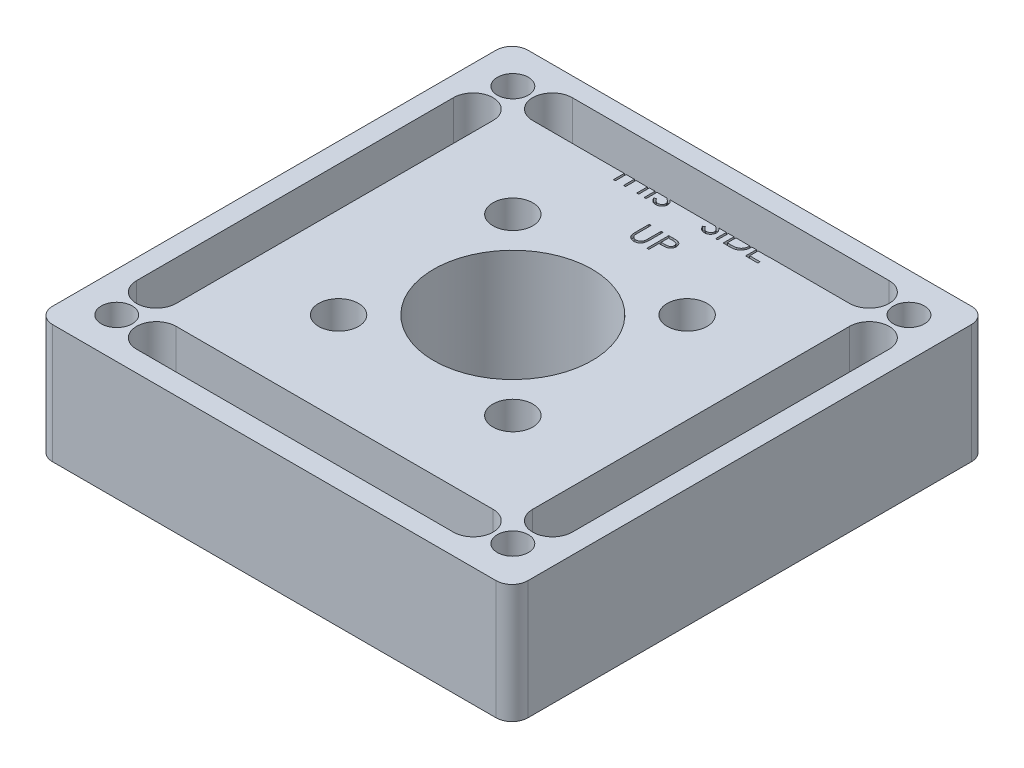
from build123d import *

# Parameters (mm, degrees)
SKETCH1_R                           = 12.7
BOSS_EXTRUDE2_DEPTH                 = 19.05
SKETCH3_R                           = 3.2
CUT_EXTRUDE2_DEPTH                  = 17.145
F_3_2_3_2_DIAMETER_HOLE2_AT_2_COUNT = 2
F_3_2_3_2_DIAMETER_HOLE2_AT_2_PITCH = 27.94
F_3_2_3_2_DIAMETER_HOLE2_AT_3_COUNT = 2
F_3_2_3_2_DIAMETER_HOLE2_AT_3_PITCH = 39.513126933
F_3_2_3_2_DIAMETER_HOLE2_AT_4_COUNT = 2
F_3_2_3_2_DIAMETER_HOLE2_AT_4_PITCH = 27.94
F_10_CLEARANCE_HOLE1_D              = 4.9784
SKETCH10_W                          = 0.314102565
SKETCH10_H                          = 3.5
SKETCH10_W_2                        = 0.314102564
CUT_EXTRUDE1_DEPTH                  = 0.635
FILLET2_R                           = 2.54
CUT_EXTRUDE3_DEPTH                  = 50.8


with BuildPart() as part:
    # Sketch1 → Boss-Extrude2 (new body)
    with BuildSketch(Plane(origin=(0, 0, 0), x_dir=(1, 0, 0), z_dir=(0, 1, 0))):
        Polygon((3.169508099, 88.395089045), (41.269508099, 88.395089045), (41.269508099, 12.195089045), (-34.930491901, 12.195089045), (-34.930491901, 88.395089045), align=None)
        with Locations(Location((3.169508099, 50.431775554, 0), (0, 0, 90))):
            Circle(SKETCH1_R, mode=Mode.SUBTRACT)
    extrude(amount=BOSS_EXTRUDE2_DEPTH)

    # Sketch3 → Cut-Extrude2 (cut)
    with BuildSketch(Plane(origin=(0, 19.05, 0), x_dir=(1, 0, 0), z_dir=(0, 1, 0))):
        with Locations(Location((17.139508099, 36.461775554, 0), (0, 0, 270))):
            Circle(SKETCH3_R)
        with Locations(Location((-10.800491901, 36.461775554, 0), (0, 0, 270))):
            Circle(SKETCH3_R)
        with Locations(Location((17.139508099, 64.401775554, 0), (0, 0, 270))):
            Circle(SKETCH3_R)
        with Locations(Location((-10.800491901, 64.401775554, 0), (0, 0, 270))):
            Circle(SKETCH3_R)
    extrude(amount=-CUT_EXTRUDE2_DEPTH, mode=Mode.SUBTRACT)

    # Sketch5 → Ø3.2 (3.2) Diameter Hole2 (revolve, cut)
    with BuildSketch(Plane(origin=(-10.800491901, 1.905, -64.401775554), x_dir=(0, 0, 1), z_dir=(1, 0, 0))):
        Polygon((0, 0), (0, 1.905), (1.6, 1.905), (1.6, 1.4), (3, 0), align=None)
    f_3_2_3_2_diameter_hole2 = revolve(axis=Axis((-10.800491901, 8.255, -64.401775554), (0, -1, 0)), mode=Mode.SUBTRACT)

    # Ø3.2 (3.2) Diameter Hole2 at 2: Ø3.2 (3.2) Diameter Hole2 ×2
    with Locations(*[(i * F_3_2_3_2_DIAMETER_HOLE2_AT_2_PITCH, 0, 0) for i in range(1, F_3_2_3_2_DIAMETER_HOLE2_AT_2_COUNT)]):
        add(f_3_2_3_2_diameter_hole2, mode=Mode.SUBTRACT)

    # Ø3.2 (3.2) Diameter Hole2 at 3: Ø3.2 (3.2) Diameter Hole2 ×2
    with Locations(*[Vector(0.7071067811865479, 0, 0.7071067811865471) * (i * F_3_2_3_2_DIAMETER_HOLE2_AT_3_PITCH) for i in range(1, F_3_2_3_2_DIAMETER_HOLE2_AT_3_COUNT)]):
        add(f_3_2_3_2_diameter_hole2, mode=Mode.SUBTRACT)

    # Ø3.2 (3.2) Diameter Hole2 at 4: Ø3.2 (3.2) Diameter Hole2 ×2
    with Locations(*[(0, 0, i * F_3_2_3_2_DIAMETER_HOLE2_AT_4_PITCH) for i in range(1, F_3_2_3_2_DIAMETER_HOLE2_AT_4_COUNT)]):
        add(f_3_2_3_2_diameter_hole2, mode=Mode.SUBTRACT)

    # #10 Clearance Hole1 (through all)
    with Locations(Plane(origin=(0, 19.05, 0), x_dir=(1, 0, 0), z_dir=(0, 1, 0))):
        with Locations((34.919508099, 82.181775554), (-28.580491901, 82.181775554), (-28.580491901, 18.681775554), (34.919508099, 18.681775554)):
            Hole(F_10_CLEARANCE_HOLE1_D / 2)

    # Sketch10 → Cut-Extrude1 (cut)
    # profile 1 of 10: a face of its own
    with BuildSketch(Plane(origin=(0, 19.05, 0), x_dir=(1, 0, 0), z_dir=(0, 1, 0))):
        Polygon((-8.308104822, 80.409203908), (-8.308104822, 80.768178267), (-6.468361233, 80.768178267), (-6.468361233, 80.409203908), (-7.231181745, 80.409203908), (-7.231181745, 77.268178267), (-7.545284309, 77.268178267), (-7.545284309, 80.409203908), align=None)
    # profile 2 of 10: a face of its own
    with BuildSketch(Plane(origin=(0, 19.05, 0), x_dir=(1, 0, 0), z_dir=(0, 1, 0))):
        Polygon((-5.929899694, 80.768178267), (-5.61579713, 80.768178267), (-5.61579713, 79.332280831), (-3.820925335, 79.332280831), (-3.820925335, 80.768178267), (-3.506822771, 80.768178267), (-3.506822771, 77.268178267), (-3.820925335, 77.268178267), (-3.820925335, 78.973306472), (-5.61579713, 78.973306472), (-5.61579713, 77.268178267), (-5.929899694, 77.268178267), align=None)
    # profile 3 of 10: a face of its own
    with BuildSketch(Plane(origin=(0, 19.05, 0), x_dir=(1, 0, 0), z_dir=(0, 1, 0))):
        with Locations((-2.452335592, 79.018178267)):
            Rectangle(SKETCH10_W, SKETCH10_H)
    # profile 4 of 10: a face of its own
    with BuildSketch(Plane(origin=(0, 19.05, 0), x_dir=(1, 0, 0), z_dir=(0, 1, 0))):
        with BuildLine():
            Line((-1.756822771, 77.943358555), (-1.460949374, 78.120742369))
            add(Edge.make_bspline(
                [(-1.460949374, 78.120742369), (-1.433431136, 78.074677984), (-1.380707256, 77.9864204), (-1.292755897, 77.86716236), (-1.201622985, 77.765800203), (-1.106633652, 77.682923596), (-1.008367704, 77.617674709), (-0.90618365, 77.571472477), (-0.800425839, 77.542656502), (-0.728452018, 77.539156415), (-0.692519886, 77.537409036)],
                knots=[0, 0, 0, 0, 1.272034388, 2.437168799, 3.508375237, 4.49857839, 5.41946034, 6.295179144, 7.148887113, 8, 8, 8, 8], degree=3))
            add(Edge.make_bspline(
                [(-0.692519886, 77.537409036), (-0.661833026, 77.538263709), (-0.600996253, 77.539958099), (-0.51143401, 77.556238901), (-0.424452208, 77.58125103), (-0.34184357, 77.617071961), (-0.264747955, 77.660410447), (-0.19714126, 77.712756624), (-0.138695147, 77.77136283), (-0.090886032, 77.836745485), (-0.054205997, 77.907062633), (-0.026013929, 77.979238585), (-0.010368855, 78.054407153), (-0.008012101, 78.105017616), (-0.006822771, 78.130558074)],
                knots=[0, 0, 0, 0, 1.095163259, 2.171163733, 3.241058638, 4.321873601, 5.38011039, 6.391990106, 7.366004449, 8.327778327, 9.272591725, 10.192022065, 11.087607919, 12, 12, 12, 12], degree=3))
            add(Edge.make_bspline(
                [(-0.006822771, 78.130558074), (-0.008297082, 78.159698924), (-0.01129414, 78.218938013), (-0.03662562, 78.306337666), (-0.076474867, 78.392830236), (-0.113237511, 78.446331502), (-0.132323572, 78.474107754)],
                knots=[0, 0, 0, 0, 0.938893495, 1.908633276, 2.914225137, 4, 4, 4, 4], degree=3))
            add(Edge.make_bspline(
                [(-0.132323572, 78.474107754), (-0.147994186, 78.494154578), (-0.180892681, 78.536240376), (-0.237450193, 78.598885612), (-0.303816308, 78.663504031), (-0.377719863, 78.732563088), (-0.461852951, 78.802850884), (-0.553580466, 78.877719162), (-0.655244325, 78.954320739), (-0.726543821, 79.005693305), (-0.763333188, 79.032200703)],
                knots=[0, 0, 0, 0, 0.722233717, 1.516239348, 2.393582979, 3.351407094, 4.387010283, 5.505090956, 6.712668013, 8, 8, 8, 8], degree=3))
            add(Edge.make_bspline(
                [(-0.763333188, 79.032200703), (-0.800157184, 79.05842929), (-0.87056186, 79.108576353), (-0.969020443, 79.183000637), (-1.057064906, 79.251044506), (-1.134303922, 79.313348518), (-1.200703519, 79.369921123), (-1.25678693, 79.420219062), (-1.301125487, 79.465602623), (-1.325781068, 79.495043965), (-1.336850816, 79.508262401)],
                knots=[0, 0, 0, 0, 1.452282411, 2.77665338, 3.964542531, 5.026858415, 5.96415736, 6.766646006, 7.446254459, 8, 8, 8, 8], degree=3))
            add(Edge.make_bspline(
                [(-1.336850816, 79.508262401), (-1.352323361, 79.528863438), (-1.382752198, 79.569378142), (-1.422918203, 79.632703), (-1.457057366, 79.697526265), (-1.483819698, 79.76402213), (-1.506355917, 79.831257059), (-1.521513848, 79.900108304), (-1.531005245, 79.970266923), (-1.531977231, 80.017480423), (-1.532463797, 80.041114966)],
                knots=[0, 0, 0, 0, 1.068054152, 2.10047183, 3.106115577, 4.101338837, 5.06977816, 6.043150881, 7.020423561, 8, 8, 8, 8], degree=3))
            add(Edge.make_bspline(
                [(-1.532463797, 80.041114966), (-1.531158588, 80.07814474), (-1.528576068, 80.151412804), (-1.50673555, 80.258443634), (-1.472262657, 80.360630051), (-1.423967769, 80.456960385), (-1.361710416, 80.544926366), (-1.289664442, 80.625539853), (-1.203852955, 80.693308435), (-1.109700332, 80.752520494), (-1.00664396, 80.798866419), (-0.898653057, 80.833827399), (-0.785555985, 80.853636657), (-0.70895285, 80.856479422), (-0.670083989, 80.857921857)],
                knots=[0, 0, 0, 0, 1.005424448, 1.989358655, 2.955360095, 3.929531133, 4.905563448, 5.876582895, 6.856512386, 7.866279853, 8.892233794, 9.918561126, 10.94386622, 12, 12, 12, 12], degree=3))
            add(Edge.make_bspline(
                [(-0.670083989, 80.857921857), (-0.628839889, 80.856499305), (-0.546818537, 80.853670304), (-0.426169321, 80.829072773), (-0.310008605, 80.788372101), (-0.21656534, 80.742183443), (-0.143432579, 80.696052027), (-0.087659846, 80.654032203), (-0.031142395, 80.605657094), (0.02657566, 80.550797848), (0.084516319, 80.488951097), (0.143539771, 80.420540408), (0.20378404, 80.345983852), (0.2425399, 80.292759351), (0.262407998, 80.26547394)],
                knots=[0, 0, 0, 0, 1.286793592, 2.559021753, 3.825965368, 5.121522368, 5.803751409, 6.523245864, 7.299691795, 8.125521123, 9.008227632, 9.944561021, 10.946284179, 12, 12, 12, 12], degree=3))
            Line((0.262407998, 80.26547394), (-0.021546329, 80.050229549))
            add(Edge.make_bspline(
                [(-0.021546329, 80.050229549), (-0.038692261, 80.072318239), (-0.071711318, 80.114855892), (-0.121840805, 80.174427208), (-0.169089453, 80.228843688), (-0.215639853, 80.276108816), (-0.259033484, 80.318810949), (-0.301150527, 80.355370706), (-0.341384878, 80.386146301), (-0.392101788, 80.418989861), (-0.455819507, 80.451546365), (-0.535804043, 80.479095443), (-0.619390318, 80.495650505), (-0.67631995, 80.497839392), (-0.705140079, 80.498947498)],
                knots=[0, 0, 0, 0, 1.181633172, 2.275549214, 3.290209073, 4.226197932, 5.078386478, 5.862611352, 6.581680152, 7.217281963, 8.414376989, 9.595101626, 10.782541182, 12, 12, 12, 12], degree=3))
            add(Edge.make_bspline(
                [(-0.705140079, 80.498947498), (-0.741296601, 80.497735798), (-0.811021049, 80.495399148), (-0.910011285, 80.469879163), (-0.99910521, 80.429697303), (-1.075657775, 80.373382325), (-1.139394752, 80.306661332), (-1.185500211, 80.229882477), (-1.213250375, 80.145100074), (-1.216636655, 80.085958418), (-1.218361233, 80.055838523)],
                knots=[0, 0, 0, 0, 1.14458467, 2.207223713, 3.21896685, 4.227309161, 5.202851033, 6.127160689, 7.046193047, 8, 8, 8, 8], degree=3))
            add(Edge.make_bspline(
                [(-1.218361233, 80.055838523), (-1.217968106, 80.037087045), (-1.21718121, 79.999553425), (-1.206206412, 79.944102003), (-1.192107083, 79.888790664), (-1.169764451, 79.833868081), (-1.138919148, 79.778373722), (-1.098413972, 79.721351984), (-1.04740066, 79.662300276), (-1.008323648, 79.623892902), (-0.987692162, 79.603614966)],
                knots=[0, 0, 0, 0, 0.858281714, 1.717966888, 2.583508476, 3.4729293, 4.427298488, 5.488583878, 6.674047936, 8, 8, 8, 8], degree=3))
            add(Edge.make_bspline(
                [(-0.987692162, 79.603614966), (-0.98003079, 79.59677794), (-0.961829123, 79.580534731), (-0.928553197, 79.553942451), (-0.884610399, 79.521139678), (-0.831148197, 79.480552362), (-0.767180836, 79.4334709), (-0.692701279, 79.380497288), (-0.608539747, 79.319911829), (-0.548817831, 79.277554288), (-0.517239438, 79.255157433)],
                knots=[0, 0, 0, 0, 0.420754252, 0.999615792, 1.744751191, 2.668019286, 3.750313428, 4.999500688, 6.413464383, 8, 8, 8, 8], degree=3))
            add(Edge.make_bspline(
                [(-0.517239438, 79.255157433), (-0.479253524, 79.227516074), (-0.405699068, 79.173992412), (-0.301041488, 79.093576732), (-0.20614768, 79.014928964), (-0.120684476, 78.938551356), (-0.043807568, 78.865023263), (0.023630153, 78.793460083), (0.082315833, 78.72437451), (0.145495051, 78.635801935), (0.210052871, 78.52702085), (0.265494378, 78.393742612), (0.300452726, 78.259946291), (0.305024241, 78.170019455), (0.307279793, 78.125650222)],
                knots=[0, 0, 0, 0, 1.163667725, 2.253281268, 3.268753668, 4.215851969, 5.092017293, 5.902905408, 6.650798638, 7.335211899, 8.59617414, 9.77448103, 10.901945474, 12, 12, 12, 12], degree=3))
            add(Edge.make_bspline(
                [(0.307279793, 78.125650222), (0.306622655, 78.094271857), (0.30532114, 78.032124473), (0.290360226, 77.940869396), (0.268440561, 77.852238527), (0.235403327, 77.767327414), (0.195080169, 77.684582652), (0.143913921, 77.606174751), (0.084606236, 77.530368353), (0.016572471, 77.459184861), (-0.057873431, 77.393838665), (-0.136557126, 77.335709604), (-0.219607399, 77.28724128), (-0.306573715, 77.247690438), (-0.397476052, 77.216756921), (-0.492283836, 77.194344052), (-0.591153347, 77.180588341), (-0.658353829, 77.179160579), (-0.692519886, 77.178434677)],
                knots=[0, 0, 0, 0, 0.983748083, 1.948392443, 2.894712957, 3.844097841, 4.80183111, 5.778335162, 6.776009319, 7.81870978, 8.863265674, 9.881300176, 10.883814829, 11.87499822, 12.874611388, 13.892143829, 14.928324115, 16, 16, 16, 16], degree=3))
            add(Edge.make_bspline(
                [(-0.692519886, 77.178434677), (-0.718955229, 77.178945859), (-0.771492989, 77.179961784), (-0.849202471, 77.188943064), (-0.925342061, 77.201650168), (-0.998956343, 77.221824238), (-1.070993754, 77.246301215), (-1.141140989, 77.276439548), (-1.209432043, 77.312556749), (-1.276249625, 77.353851774), (-1.3414238, 77.401909518), (-1.404343268, 77.457883015), (-1.467072453, 77.52022852), (-1.52775985, 77.590639083), (-1.587632994, 77.667977166), (-1.645511404, 77.752966349), (-1.702593121, 77.845143703), (-1.738408589, 77.910008789), (-1.756822771, 77.943358555)],
                knots=[0, 0, 0, 0, 0.915332311, 1.819136955, 2.706846663, 3.586547465, 4.459518054, 5.340707479, 6.227863349, 7.133153174, 8.059268498, 9.028702269, 10.047606654, 11.120612155, 12.245963614, 13.433783089, 14.680604001, 16, 16, 16, 16], degree=3))
        make_face()
    # profile 5 of 10: a face of its own
    with BuildSketch(Plane(origin=(0, 19.05, 0), x_dir=(1, 0, 0), z_dir=(0, 1, 0))):
        with BuildLine():
            Line((6.050869537, 77.943358555), (6.346742934, 78.120742369))
            add(Edge.make_bspline(
                [(6.346742934, 78.120742369), (6.374261171, 78.074677984), (6.426985052, 77.9864204), (6.514936411, 77.86716236), (6.606069322, 77.765800203), (6.701058656, 77.682923596), (6.799324604, 77.617674709), (6.901508658, 77.571472477), (7.007266468, 77.542656502), (7.07924029, 77.539156415), (7.115172421, 77.537409036)],
                knots=[0, 0, 0, 0, 1.272034388, 2.437168799, 3.508375237, 4.49857839, 5.41946034, 6.295179144, 7.148887113, 8, 8, 8, 8], degree=3))
            add(Edge.make_bspline(
                [(7.115172421, 77.537409036), (7.145859282, 77.538263709), (7.206696055, 77.539958099), (7.296258298, 77.556238901), (7.3832401, 77.58125103), (7.465848738, 77.617071961), (7.542944352, 77.660410447), (7.610551048, 77.712756624), (7.668997161, 77.77136283), (7.716806275, 77.836745485), (7.753486311, 77.907062633), (7.781678379, 77.979238585), (7.797323453, 78.054407153), (7.799680206, 78.105017616), (7.800869537, 78.130558074)],
                knots=[0, 0, 0, 0, 1.095163259, 2.171163733, 3.241058638, 4.321873601, 5.38011039, 6.391990106, 7.366004449, 8.327778327, 9.272591725, 10.192022065, 11.087607919, 12, 12, 12, 12], degree=3))
            add(Edge.make_bspline(
                [(7.800869537, 78.130558074), (7.799395226, 78.159698924), (7.796398168, 78.218938013), (7.771066688, 78.306337666), (7.731217441, 78.392830236), (7.694454797, 78.446331502), (7.675368735, 78.474107754)],
                knots=[0, 0, 0, 0, 0.938893495, 1.908633276, 2.914225137, 4, 4, 4, 4], degree=3))
            add(Edge.make_bspline(
                [(7.675368735, 78.474107754), (7.659698121, 78.494154578), (7.626799627, 78.536240376), (7.570242114, 78.598885612), (7.503876, 78.663504031), (7.429972445, 78.732563088), (7.345839356, 78.802850884), (7.254111842, 78.877719162), (7.152447983, 78.954320739), (7.081148486, 79.005693305), (7.04435912, 79.032200703)],
                knots=[0, 0, 0, 0, 0.722233717, 1.516239348, 2.393582979, 3.351407094, 4.387010283, 5.505090956, 6.712668013, 8, 8, 8, 8], degree=3))
            add(Edge.make_bspline(
                [(7.04435912, 79.032200703), (7.007535124, 79.05842929), (6.937130447, 79.108576353), (6.838671865, 79.183000637), (6.750627402, 79.251044506), (6.673388385, 79.313348518), (6.606988789, 79.369921123), (6.550905377, 79.420219062), (6.50656682, 79.465602623), (6.48191124, 79.495043965), (6.470841492, 79.508262401)],
                knots=[0, 0, 0, 0, 1.452282411, 2.77665338, 3.964542531, 5.026858415, 5.96415736, 6.766646006, 7.446254459, 8, 8, 8, 8], degree=3))
            add(Edge.make_bspline(
                [(6.470841492, 79.508262401), (6.455368947, 79.528863438), (6.42494011, 79.569378142), (6.384774104, 79.632703), (6.350634942, 79.697526265), (6.323872609, 79.76402213), (6.301336391, 79.831257059), (6.28617846, 79.900108304), (6.276687063, 79.970266923), (6.275715076, 80.017480423), (6.275228511, 80.041114966)],
                knots=[0, 0, 0, 0, 1.068054152, 2.10047183, 3.106115577, 4.101338837, 5.06977816, 6.043150881, 7.020423561, 8, 8, 8, 8], degree=3))
            add(Edge.make_bspline(
                [(6.275228511, 80.041114966), (6.27653372, 80.07814474), (6.27911624, 80.151412804), (6.300956757, 80.258443634), (6.335429651, 80.360630051), (6.383724539, 80.456960385), (6.445981892, 80.544926366), (6.518027866, 80.625539853), (6.603839352, 80.693308435), (6.697991976, 80.752520494), (6.801048348, 80.798866419), (6.909039251, 80.833827399), (7.022136323, 80.853636657), (7.098739458, 80.856479422), (7.137608319, 80.857921857)],
                knots=[0, 0, 0, 0, 1.005424448, 1.989358655, 2.955360095, 3.929531133, 4.905563448, 5.876582895, 6.856512386, 7.866279853, 8.892233794, 9.918561126, 10.94386622, 12, 12, 12, 12], degree=3))
            add(Edge.make_bspline(
                [(7.137608319, 80.857921857), (7.178852419, 80.856499305), (7.260873771, 80.853670304), (7.381522986, 80.829072773), (7.497683703, 80.788372101), (7.591126968, 80.742183443), (7.664259729, 80.696052027), (7.720032462, 80.654032203), (7.776549912, 80.605657094), (7.834267967, 80.550797848), (7.892208627, 80.488951097), (7.951232079, 80.420540408), (8.011476348, 80.345983852), (8.050232208, 80.292759351), (8.070100306, 80.26547394)],
                knots=[0, 0, 0, 0, 1.286793592, 2.559021753, 3.825965368, 5.121522368, 5.803751409, 6.523245864, 7.299691795, 8.125521123, 9.008227632, 9.944561021, 10.946284179, 12, 12, 12, 12], degree=3))
            Line((8.070100306, 80.26547394), (7.786145979, 80.050229549))
            add(Edge.make_bspline(
                [(7.786145979, 80.050229549), (7.769000046, 80.072318239), (7.735980989, 80.114855892), (7.685851503, 80.174427208), (7.638602855, 80.228843688), (7.592052455, 80.276108816), (7.548658823, 80.318810949), (7.506541781, 80.355370706), (7.46630743, 80.386146301), (7.415590519, 80.418989861), (7.351872801, 80.451546365), (7.271888265, 80.479095443), (7.18830199, 80.495650505), (7.131372358, 80.497839392), (7.102552229, 80.498947498)],
                knots=[0, 0, 0, 0, 1.181633172, 2.275549214, 3.290209073, 4.226197932, 5.078386478, 5.862611352, 6.581680152, 7.217281963, 8.414376989, 9.595101626, 10.782541182, 12, 12, 12, 12], degree=3))
            add(Edge.make_bspline(
                [(7.102552229, 80.498947498), (7.066395707, 80.497735798), (6.996671259, 80.495399148), (6.897681023, 80.469879163), (6.808587098, 80.429697303), (6.732034533, 80.373382325), (6.668297556, 80.306661332), (6.622192097, 80.229882477), (6.594441933, 80.145100074), (6.591055653, 80.085958418), (6.589331075, 80.055838523)],
                knots=[0, 0, 0, 0, 1.14458467, 2.207223713, 3.21896685, 4.227309161, 5.202851033, 6.127160689, 7.046193047, 8, 8, 8, 8], degree=3))
            add(Edge.make_bspline(
                [(6.589331075, 80.055838523), (6.589724202, 80.037087045), (6.590511098, 79.999553425), (6.601485896, 79.944102003), (6.615585225, 79.888790664), (6.637927856, 79.833868081), (6.66877316, 79.778373722), (6.709278336, 79.721351984), (6.760291648, 79.662300276), (6.79936866, 79.623892902), (6.820000146, 79.603614966)],
                knots=[0, 0, 0, 0, 0.858281714, 1.717966888, 2.583508476, 3.4729293, 4.427298488, 5.488583878, 6.674047936, 8, 8, 8, 8], degree=3))
            add(Edge.make_bspline(
                [(6.820000146, 79.603614966), (6.827661518, 79.59677794), (6.845863185, 79.580534731), (6.879139111, 79.553942451), (6.923081909, 79.521139678), (6.97654411, 79.480552362), (7.040511472, 79.4334709), (7.114991028, 79.380497288), (7.199152561, 79.319911829), (7.258874477, 79.277554288), (7.29045287, 79.255157433)],
                knots=[0, 0, 0, 0, 0.420754252, 0.999615792, 1.744751191, 2.668019286, 3.750313428, 4.999500688, 6.413464383, 8, 8, 8, 8], degree=3))
            add(Edge.make_bspline(
                [(7.29045287, 79.255157433), (7.328438783, 79.227516074), (7.40199324, 79.173992412), (7.50665082, 79.093576732), (7.601544628, 79.014928964), (7.687007831, 78.938551356), (7.76388474, 78.865023263), (7.83132246, 78.793460083), (7.890008141, 78.72437451), (7.953187359, 78.635801935), (8.017745179, 78.52702085), (8.073186686, 78.393742612), (8.108145034, 78.259946291), (8.112716549, 78.170019455), (8.114972101, 78.125650222)],
                knots=[0, 0, 0, 0, 1.163667725, 2.253281268, 3.268753668, 4.215851969, 5.092017293, 5.902905408, 6.650798638, 7.335211899, 8.59617414, 9.77448103, 10.901945474, 12, 12, 12, 12], degree=3))
            add(Edge.make_bspline(
                [(8.114972101, 78.125650222), (8.114314963, 78.094271857), (8.113013448, 78.032124473), (8.098052534, 77.940869396), (8.076132869, 77.852238527), (8.043095635, 77.767327414), (8.002772476, 77.684582652), (7.951606229, 77.606174751), (7.892298544, 77.530368353), (7.824264779, 77.459184861), (7.749818877, 77.393838665), (7.671135182, 77.335709604), (7.588084909, 77.28724128), (7.501118592, 77.247690438), (7.410216256, 77.216756921), (7.315408472, 77.194344052), (7.216538961, 77.180588341), (7.149338479, 77.179160579), (7.115172421, 77.178434677)],
                knots=[0, 0, 0, 0, 0.983748083, 1.948392443, 2.894712957, 3.844097841, 4.80183111, 5.778335162, 6.776009319, 7.81870978, 8.863265674, 9.881300176, 10.883814829, 11.87499822, 12.874611388, 13.892143829, 14.928324115, 16, 16, 16, 16], degree=3))
            add(Edge.make_bspline(
                [(7.115172421, 77.178434677), (7.088737078, 77.178945859), (7.036199318, 77.179961784), (6.958489836, 77.188943064), (6.882350247, 77.201650168), (6.808735965, 77.221824238), (6.736698553, 77.246301215), (6.666551319, 77.276439548), (6.598260265, 77.312556749), (6.531442682, 77.353851774), (6.466268508, 77.401909518), (6.40334904, 77.457883015), (6.340619854, 77.52022852), (6.279932458, 77.590639083), (6.220059314, 77.667977166), (6.162180904, 77.752966349), (6.105099186, 77.845143703), (6.069283719, 77.910008789), (6.050869537, 77.943358555)],
                knots=[0, 0, 0, 0, 0.915332311, 1.819136955, 2.706846663, 3.586547465, 4.459518054, 5.340707479, 6.227863349, 7.133153174, 8.059268498, 9.028702269, 10.047606654, 11.120612155, 12.245963614, 13.433783089, 14.680604001, 16, 16, 16, 16], degree=3))
        make_face()
    # profile 6 of 10: a face of its own
    with BuildSketch(Plane(origin=(0, 19.05, 0), x_dir=(1, 0, 0), z_dir=(0, 1, 0))):
        with Locations((8.989972101, 79.018178267)):
            Rectangle(SKETCH10_W_2, SKETCH10_H)
    # profile 7 of 10: a face of its own
    with BuildSketch(Plane(origin=(0, 19.05, 0), x_dir=(1, 0, 0), z_dir=(0, 1, 0))):
        with BuildLine():
            Line((10.04445928, 77.268178267), (10.04445928, 80.768178267))
            Line((10.04445928, 80.768178267), (10.751190049, 80.768178267))
            add(Edge.make_bspline(
                [(10.751190049, 80.768178267), (10.812659038, 80.767735697), (10.931416803, 80.766880654), (11.10302925, 80.761459263), (11.261813013, 80.751868797), (11.407245872, 80.737899271), (11.539727084, 80.720746237), (11.658885692, 80.699245833), (11.765337835, 80.673857662), (11.830807276, 80.652212212), (11.861766973, 80.641976344)],
                knots=[0, 0, 0, 0, 1.314313732, 2.53924729, 3.670748893, 4.714932338, 5.66265055, 6.526160246, 7.303039223, 8, 8, 8, 8], degree=3))
            add(Edge.make_bspline(
                [(11.861766973, 80.641976344), (11.902261712, 80.626545638), (11.982332904, 80.596034144), (12.096340027, 80.538477843), (12.20366539, 80.473264741), (12.304884535, 80.400308878), (12.397685361, 80.31754453), (12.485693258, 80.228487444), (12.565307981, 80.129899104), (12.638216278, 80.023824116), (12.703951937, 79.911512064), (12.761091095, 79.793176955), (12.808545088, 79.669419747), (12.847938315, 79.540584599), (12.878984772, 79.406388221), (12.900166704, 79.266674355), (12.914137694, 79.121995166), (12.915541745, 79.023820702), (12.916254152, 78.974007594)],
                knots=[0, 0, 0, 0, 0.984719456, 1.947108742, 2.898477687, 3.838006223, 4.779231079, 5.722358779, 6.681677486, 7.655904652, 8.64651281, 9.637519902, 10.640069247, 11.656948941, 12.698408672, 13.768548281, 14.867775369, 16, 16, 16, 16], degree=3))
            add(Edge.make_bspline(
                [(12.916254152, 78.974007594), (12.915625185, 78.930746355), (12.914385738, 78.845495566), (12.903256423, 78.719854671), (12.887080103, 78.597941099), (12.862035905, 78.480335399), (12.831633391, 78.366007181), (12.79266924, 78.256174937), (12.748033744, 78.149831128), (12.695983865, 78.048413652), (12.63884248, 77.952330279), (12.577520737, 77.861754751), (12.512084042, 77.77797953), (12.441908409, 77.700750918), (12.367900692, 77.630185339), (12.289576362, 77.565693324), (12.206733311, 77.508536769), (12.119742588, 77.456469661), (12.026066459, 77.411049305), (11.923930593, 77.372619295), (11.812899415, 77.34077268), (11.693245458, 77.314201784), (11.56476198, 77.293124482), (11.427323014, 77.278998089), (11.281139725, 77.269445156), (11.180760459, 77.268608763), (11.129094697, 77.268178267)],
                knots=[0, 0, 0, 0, 1.105936401, 2.179363191, 3.223086493, 4.248585256, 5.251745608, 6.245858792, 7.225916811, 8.198733463, 9.158002045, 10.082870192, 10.993790845, 11.873723703, 12.748670949, 13.606408763, 14.465103618, 15.319838547, 16.196477973, 17.123216899, 18.106603292, 19.147568657, 20.255746949, 21.433717677, 22.679120308, 24, 24, 24, 24], degree=3))
            Line((11.129094697, 77.268178267), (10.04445928, 77.268178267))
        make_face()
        with BuildLine():
            Line((10.358561844, 77.627152626), (10.760304633, 77.627152626))
            add(Edge.make_bspline(
                [(10.760304633, 77.627152626), (10.818033004, 77.627400722), (10.929065802, 77.627877902), (11.088723799, 77.632065105), (11.234603196, 77.638907043), (11.366724705, 77.648482121), (11.485013729, 77.661150736), (11.589717479, 77.675275639), (11.680492738, 77.692873089), (11.735422175, 77.708824049), (11.760805434, 77.716195094)],
                knots=[0, 0, 0, 0, 1.375205317, 2.645023457, 3.804390687, 4.853969522, 5.800190428, 6.637939096, 7.370582563, 8, 8, 8, 8], degree=3))
            add(Edge.make_bspline(
                [(11.760805434, 77.716195094), (11.792753796, 77.727446652), (11.855887434, 77.749681025), (11.94676852, 77.790238686), (12.031525524, 77.838280756), (12.11163555, 77.89168303), (12.185962205, 77.952329032), (12.255386321, 78.018900021), (12.319768123, 78.091734796), (12.378442431, 78.170742958), (12.430950735, 78.255432753), (12.476421964, 78.344971587), (12.516273496, 78.438378397), (12.547552088, 78.537087556), (12.572067672, 78.640216614), (12.58943236, 78.747772827), (12.600247085, 78.859736109), (12.601508533, 78.935888234), (12.602151588, 78.974708716)],
                knots=[0, 0, 0, 0, 0.998632004, 1.973411704, 2.929992603, 3.868527914, 4.809262121, 5.754881198, 6.702106254, 7.672490631, 8.653608572, 9.636854334, 10.631411391, 11.644891563, 12.686317036, 13.754757253, 14.855430412, 16, 16, 16, 16], degree=3))
            add(Edge.make_bspline(
                [(12.602151588, 78.974708716), (12.601638301, 79.015642196), (12.600629943, 79.09605638), (12.587955633, 79.214047075), (12.569434077, 79.327527726), (12.542650391, 79.436505921), (12.508519512, 79.541194274), (12.46592487, 79.641013784), (12.417258251, 79.737018653), (12.359354914, 79.826993018), (12.295939321, 79.912086127), (12.225561442, 79.990041043), (12.149339403, 80.061035343), (12.068104554, 80.126174656), (11.979567454, 80.182838332), (11.885813764, 80.233525013), (11.785468092, 80.276540904), (11.715655397, 80.299419767), (11.680176428, 80.311046857)],
                knots=[0, 0, 0, 0, 1.122418816, 2.205001699, 3.251619955, 4.274784885, 5.280384055, 6.268708349, 7.249350384, 8.229342522, 9.199999885, 10.157847722, 11.105861043, 12.055065948, 13.010012805, 13.98527497, 14.976112212, 16, 16, 16, 16], degree=3))
            add(Edge.make_bspline(
                [(11.680176428, 80.311046857), (11.650825281, 80.319163284), (11.588416691, 80.336421037), (11.486577227, 80.355246409), (11.371962078, 80.371850909), (11.244062376, 80.385908948), (11.103023917, 80.395996269), (10.948738229, 80.403567584), (10.781138625, 80.408674216), (10.664956091, 80.409022923), (10.604655594, 80.409203908)],
                knots=[0, 0, 0, 0, 0.674548936, 1.434276114, 2.292660221, 3.240891867, 4.284742987, 5.42552168, 6.663806718, 8, 8, 8, 8], degree=3))
            Line((10.604655594, 80.409203908), (10.358561844, 80.409203908))
            Line((10.358561844, 80.409203908), (10.358561844, 77.627152626))
        make_face(mode=Mode.SUBTRACT)
    # profile 8 of 10: a face of its own
    with BuildSketch(Plane(origin=(0, 19.05, 0), x_dir=(1, 0, 0), z_dir=(0, 1, 0))):
        Polygon((13.63420287, 80.768178267), (15.608561844, 80.768178267), (15.608561844, 80.409203908), (13.948305434, 80.409203908), (13.948305434, 79.332280831), (15.608561844, 79.332280831), (15.608561844, 78.973306472), (13.948305434, 78.973306472), (13.948305434, 77.627152626), (15.608561844, 77.627152626), (15.608561844, 77.268178267), (13.63420287, 77.268178267), align=None)
    # profile 9 of 10: a face of its own
    with BuildSketch(Plane(origin=(0, 19.05, 0), x_dir=(1, 0, 0), z_dir=(0, 1, 0))):
        with BuildLine():
            Line((1.518818255, 73.934844933), (1.832920819, 73.934844933))
            Line((1.832920819, 73.934844933), (1.832920819, 71.837789645))
            add(Edge.make_bspline(
                [(1.832920819, 71.837789645), (1.832874075, 71.808108909), (1.83278537, 71.751784598), (1.833377884, 71.671616298), (1.835037252, 71.600343839), (1.836083412, 71.537692491), (1.838410745, 71.483949744), (1.840308792, 71.438824433), (1.842749349, 71.402530231), (1.845682466, 71.381349305), (1.846943255, 71.372244773)],
                knots=[0, 0, 0, 0, 1.528628734, 2.90083645, 4.128790002, 5.200304208, 6.127813768, 6.898992206, 7.526736466, 8, 8, 8, 8], degree=3))
            add(Edge.make_bspline(
                [(1.846943255, 71.372244773), (1.852120713, 71.33939801), (1.8621839, 71.275555281), (1.887830278, 71.184646999), (1.923647779, 71.102715541), (1.966090821, 71.027204249), (2.022023433, 70.960214889), (2.089026968, 70.898503237), (2.170204736, 70.844531432), (2.260465342, 70.79518062), (2.35775058, 70.755515538), (2.457161846, 70.725522173), (2.557204825, 70.707243274), (2.62418099, 70.705126735), (2.657440049, 70.704075703)],
                knots=[0, 0, 0, 0, 1.035780045, 2.013197591, 2.933192213, 3.817615948, 4.702609284, 5.640816605, 6.646850145, 7.73207398, 8.84249596, 9.914020372, 10.964143139, 12, 12, 12, 12], degree=3))
            add(Edge.make_bspline(
                [(2.657440049, 70.704075703), (2.68599379, 70.705149553), (2.742936352, 70.707291051), (2.827542782, 70.720552482), (2.909942891, 70.744453048), (2.990543571, 70.775292806), (3.066094555, 70.816040397), (3.136637997, 70.863111237), (3.199601932, 70.918322113), (3.25705993, 70.979422457), (3.307094865, 71.048362257), (3.350466007, 71.123640396), (3.385991937, 71.206389742), (3.403535461, 71.264544165), (3.412548223, 71.294420254)],
                knots=[0, 0, 0, 0, 0.994687771, 1.983630487, 2.973142513, 3.978332533, 4.983357753, 5.956394766, 6.925816176, 7.893390482, 8.871859704, 9.88551698, 10.913711441, 12, 12, 12, 12], degree=3))
            add(Edge.make_bspline(
                [(3.412548223, 71.294420254), (3.415548348, 71.306768828), (3.422233836, 71.334286428), (3.428480881, 71.380807719), (3.434987406, 71.435697083), (3.439501976, 71.499348896), (3.443903197, 71.571549868), (3.44653627, 71.652676126), (3.447753303, 71.742433087), (3.448115983, 71.805070248), (3.448305434, 71.837789645)],
                knots=[0, 0, 0, 0, 0.558680831, 1.244966039, 2.062412453, 2.990489873, 4.051219941, 5.244515665, 6.560634259, 8, 8, 8, 8], degree=3))
            Line((3.448305434, 71.837789645), (3.448305434, 73.934844933))
            Line((3.448305434, 73.934844933), (3.762407998, 73.934844933))
            Line((3.762407998, 73.934844933), (3.762407998, 71.820962722))
            add(Edge.make_bspline(
                [(3.762407998, 71.820962722), (3.762153878, 71.782864343), (3.761657946, 71.70851304), (3.75735737, 71.599561681), (3.75050037, 71.4962087), (3.740812282, 71.398440203), (3.727975279, 71.306606044), (3.713700058, 71.219901276), (3.695520525, 71.138948283), (3.674287124, 71.063115865), (3.650013576, 70.990930352), (3.618572428, 70.922421737), (3.583147928, 70.855507338), (3.541133275, 70.791199229), (3.493921892, 70.729212676), (3.440470212, 70.669923601), (3.382546051, 70.612384554), (3.319186491, 70.558071488), (3.251435966, 70.508262811), (3.179496008, 70.46446504), (3.103919238, 70.427441423), (3.024902112, 70.396965498), (2.942410909, 70.374050899), (2.85644355, 70.356975743), (2.766804356, 70.347273446), (2.7058397, 70.345831516), (2.674968094, 70.345101344)],
                knots=[0, 0, 0, 0, 1.316592851, 2.569410997, 3.76748051, 4.895814652, 5.963796859, 6.97159953, 7.931736103, 8.829262218, 9.692595152, 10.560224239, 11.431080259, 12.30701507, 13.211635791, 14.121146779, 15.063487852, 16.031507147, 17.00238618, 17.966455255, 18.938106653, 19.907068911, 20.888905087, 21.893141452, 22.933117798, 24, 24, 24, 24], degree=3))
            add(Edge.make_bspline(
                [(2.674968094, 70.345101344), (2.641298992, 70.345886109), (2.575240333, 70.347425816), (2.477902266, 70.356248566), (2.384588069, 70.37286696), (2.294312192, 70.394026904), (2.208303695, 70.423210641), (2.125410251, 70.457308766), (2.04705157, 70.499186026), (1.971956441, 70.545779419), (1.902131685, 70.598204057), (1.838034282, 70.655344231), (1.779558411, 70.716284609), (1.727689715, 70.781684975), (1.68156883, 70.851036682), (1.641838617, 70.924535921), (1.607725373, 71.002154237), (1.590118806, 71.056107438), (1.581218094, 71.083382594)],
                knots=[0, 0, 0, 0, 1.13879206, 2.234305948, 3.301075583, 4.341971843, 5.366689343, 6.369221514, 7.369726634, 8.367512178, 9.355451585, 10.318319045, 11.268648973, 12.207971039, 13.137398894, 14.081662264, 15.030215811, 16, 16, 16, 16], degree=3))
            add(Edge.make_bspline(
                [(1.581218094, 71.083382594), (1.576040936, 71.102015168), (1.564811565, 71.142429637), (1.552786267, 71.209316126), (1.542677186, 71.286331043), (1.533171627, 71.373479662), (1.527562669, 71.470829528), (1.522645231, 71.578338444), (1.518783612, 71.696136406), (1.518806384, 71.778190921), (1.518818255, 71.820962722)],
                knots=[0, 0, 0, 0, 0.625038921, 1.35572334, 2.194682327, 3.136881307, 4.189498639, 5.346923369, 6.617055217, 8, 8, 8, 8], degree=3))
            Line((1.518818255, 71.820962722), (1.518818255, 73.934844933))
        make_face()
    # profile 10 of 10: a face of its own
    with BuildSketch(Plane(origin=(0, 19.05, 0), x_dir=(1, 0, 0), z_dir=(0, 1, 0))):
        with BuildLine():
            Line((4.659843896, 73.934844933), (5.346242133, 73.934844933))
            add(Edge.make_bspline(
                [(5.346242133, 73.934844933), (5.393453039, 73.934793037), (5.483911232, 73.934693602), (5.613626287, 73.931678856), (5.731436019, 73.927652164), (5.8370864, 73.922070271), (5.930902498, 73.91547368), (6.012459798, 73.906221641), (6.082399354, 73.896561345), (6.124305803, 73.886739939), (6.143417614, 73.882260799)],
                knots=[0, 0, 0, 0, 1.415646017, 2.712440637, 3.8905458, 4.950247383, 5.884950622, 6.709939814, 7.411656543, 8, 8, 8, 8], degree=3))
            add(Edge.make_bspline(
                [(6.143417614, 73.882260799), (6.167611147, 73.875638849), (6.215428125, 73.862550987), (6.284329168, 73.836337264), (6.349883013, 73.805255099), (6.412314572, 73.769831159), (6.470856655, 73.728545595), (6.526382696, 73.683071977), (6.578402676, 73.632360408), (6.626624068, 73.576979668), (6.670908865, 73.517859459), (6.709038548, 73.454117229), (6.740965775, 73.386825925), (6.768349047, 73.316032354), (6.788057501, 73.241142031), (6.802904401, 73.162675318), (6.812328028, 73.080640628), (6.81323059, 73.024580761), (6.813690049, 72.99604285)],
                knots=[0, 0, 0, 0, 0.999701418, 1.975846123, 2.934577507, 3.890451536, 4.834027766, 5.787354733, 6.749476667, 7.726910423, 8.712836071, 9.690891519, 10.682875813, 11.679750201, 12.712814741, 13.765529915, 14.8625177, 16, 16, 16, 16], degree=3))
            add(Edge.make_bspline(
                [(6.813690049, 72.99604285), (6.813268625, 72.967265073), (6.812444079, 72.910959409), (6.802547793, 72.828586621), (6.789217602, 72.749868231), (6.76872055, 72.674978781), (6.741874876, 72.60436301), (6.710382824, 72.536941778), (6.672399293, 72.473862106), (6.628754464, 72.414894989), (6.580202869, 72.359985076), (6.526949931, 72.309530282), (6.469210638, 72.263825943), (6.40716849, 72.2227696), (6.340218642, 72.18731332), (6.269376488, 72.155556015), (6.194026272, 72.128884955), (6.141883758, 72.114854893), (6.115372742, 72.107721536)],
                knots=[0, 0, 0, 0, 1.121902311, 2.195077645, 3.232258892, 4.234102512, 5.217864754, 6.176164875, 7.132989551, 8.084763148, 9.034132444, 9.988522005, 10.94243251, 11.903244335, 12.886203696, 13.894208494, 14.929344452, 16, 16, 16, 16], degree=3))
            add(Edge.make_bspline(
                [(6.115372742, 72.107721536), (6.093445408, 72.103058555), (6.04539038, 72.092839361), (5.966247658, 72.081430904), (5.874102272, 72.071693303), (5.769079992, 72.064392166), (5.651275087, 72.058141797), (5.52062383, 72.053173703), (5.376869753, 72.050443849), (5.276598509, 72.050303057), (5.224246941, 72.050229549)],
                knots=[0, 0, 0, 0, 0.601384939, 1.31797006, 2.144135048, 3.087295005, 4.142315834, 5.309527816, 6.595305764, 8, 8, 8, 8], degree=3))
            Line((5.224246941, 72.050229549), (4.97394646, 72.050229549))
            Line((4.97394646, 72.050229549), (4.97394646, 70.434844933))
            Line((4.97394646, 70.434844933), (4.659843896, 70.434844933))
            Line((4.659843896, 70.434844933), (4.659843896, 73.934844933))
        make_face()
        with BuildLine():
            Line((4.97394646, 73.575870574), (4.97394646, 72.409203908))
            Line((4.97394646, 72.409203908), (5.586726908, 72.401491568))
            add(Edge.make_bspline(
                [(5.586726908, 72.401491568), (5.616646834, 72.401476104), (5.674406634, 72.401446252), (5.757842857, 72.405431476), (5.835252145, 72.410032008), (5.90639672, 72.416767932), (5.971308655, 72.426289189), (6.030096183, 72.435900927), (6.082303466, 72.44980629), (6.143402668, 72.468529359), (6.211486016, 72.500461975), (6.285553564, 72.546811865), (6.34832415, 72.605892573), (6.402642447, 72.672320404), (6.445748325, 72.746219534), (6.477304317, 72.82528847), (6.495845475, 72.90871632), (6.498331669, 72.965804459), (6.499587485, 72.994640607)],
                knots=[0, 0, 0, 0, 1.160613943, 2.240541288, 3.23993089, 4.169200891, 5.011653406, 5.7853311, 6.478053781, 7.106038997, 8.262395093, 9.384106736, 10.481365981, 11.59014053, 12.70357646, 13.786202915, 14.881775077, 16, 16, 16, 16], degree=3))
            add(Edge.make_bspline(
                [(6.499587485, 72.994640607), (6.498324839, 73.02277912), (6.495814854, 73.078715002), (6.477158991, 73.160693763), (6.445809677, 73.238929467), (6.402353082, 73.311902552), (6.349611952, 73.378091356), (6.288312609, 73.435588484), (6.218599348, 73.481810186), (6.153751117, 73.511643468), (6.096149931, 73.529858743), (6.046117971, 73.542603584), (5.989627297, 73.55277919), (5.926659517, 73.561018693), (5.857702683, 73.568072154), (5.782164368, 73.572858131), (5.700330725, 73.575659588), (5.643520154, 73.575798543), (5.614070658, 73.575870574)],
                knots=[0, 0, 0, 0, 1.120700087, 2.227813068, 3.331159281, 4.466773991, 5.599788987, 6.693661531, 7.80175334, 8.91857717, 9.525282508, 10.207424825, 10.974604443, 11.810962634, 12.737642355, 13.736264703, 14.826523623, 16, 16, 16, 16], degree=3))
            Line((5.614070658, 73.575870574), (4.97394646, 73.575870574))
        make_face(mode=Mode.SUBTRACT)
    extrude(amount=-CUT_EXTRUDE1_DEPTH, mode=Mode.SUBTRACT)

    # Fillet2
    fillet2_edges = [part.edges().sort_by_distance(p)[0] for p in [
        (41.269508099, 9.525, -88.395089045),
        (41.269508099, 9.525, -12.195089045),
        (-34.930491901, 9.525, -12.195089045),
        (-34.930491901, 9.525, -88.395089045),
    ]]
    fillet(fillet2_edges, radius=FILLET2_R)

    # Sketch11 → Cut-Extrude3 (cut)
    with BuildSketch(Plane(origin=(0, 19.05, 0), x_dir=(1, 0, 0), z_dir=(0, 1, 0))):
        with BuildLine():
            Line((-25.405491901, 75.831775554), (-25.405491901, 25.031775554))
            ThreePointArc((-25.405491901, 25.031775554), (-28.580491901, 21.856775554), (-31.755491901, 25.031775554))
            Line((-31.755491901, 25.031775554), (-31.755491901, 75.831775554))
            ThreePointArc((-31.755491901, 75.831775554), (-28.580491901, 79.006775554), (-25.405491901, 75.831775554))
        make_face()
        with BuildLine():
            Line((-22.230491901, 85.356775554), (28.569508099, 85.356775554))
            ThreePointArc((28.569508099, 85.356775554), (31.744508099, 82.181775554), (28.569508099, 79.006775554))
            Line((28.569508099, 79.006775554), (-22.230491901, 79.006775554))
            ThreePointArc((-22.230491901, 79.006775554), (-25.405491901, 82.181775554), (-22.230491901, 85.356775554))
        make_face()
        with BuildLine():
            Line((38.094508099, 75.831775554), (38.094508099, 25.031775554))
            ThreePointArc((38.094508099, 25.031775554), (34.919508099, 21.856775554), (31.744508099, 25.031775554))
            Line((31.744508099, 25.031775554), (31.744508099, 75.831775554))
            ThreePointArc((31.744508099, 75.831775554), (34.919508099, 79.006775554), (38.094508099, 75.831775554))
        make_face()
        with BuildLine():
            Line((28.569508099, 15.506775554), (-22.230491901, 15.506775554))
            ThreePointArc((-22.230491901, 15.506775554), (-25.405491901, 18.681775554), (-22.230491901, 21.856775554))
            Line((-22.230491901, 21.856775554), (28.569508099, 21.856775554))
            ThreePointArc((28.569508099, 21.856775554), (31.744508099, 18.681775554), (28.569508099, 15.506775554))
        make_face()
    extrude(amount=-CUT_EXTRUDE3_DEPTH, mode=Mode.SUBTRACT)


solid = part.part
